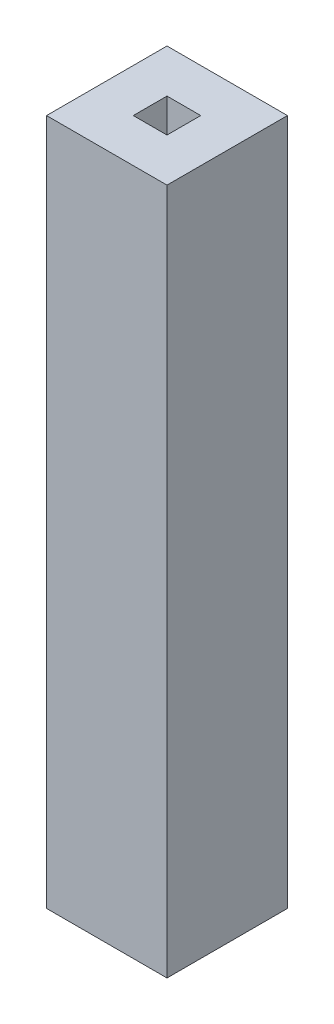
from build123d import *

# Parameters (mm, degrees)
SKETCH1_W           = 2.5
SKETCH1_H           = 2.5
SKETCH1_W_2         = 0.7
SKETCH1_H_2         = 0.7
EXTRUDE_THIN1_DEPTH = 14.25


with BuildPart() as part:
    # Sketch1 → Extrude-Thin1 (new body)
    with BuildSketch(Plane(origin=(0, 0, 0), x_dir=(1, 0, 0), z_dir=(0, 1, 0))):
        Rectangle(SKETCH1_W, SKETCH1_H)
        Rectangle(SKETCH1_W_2, SKETCH1_H_2, mode=Mode.SUBTRACT)
    extrude(amount=EXTRUDE_THIN1_DEPTH)


solid = part.part
